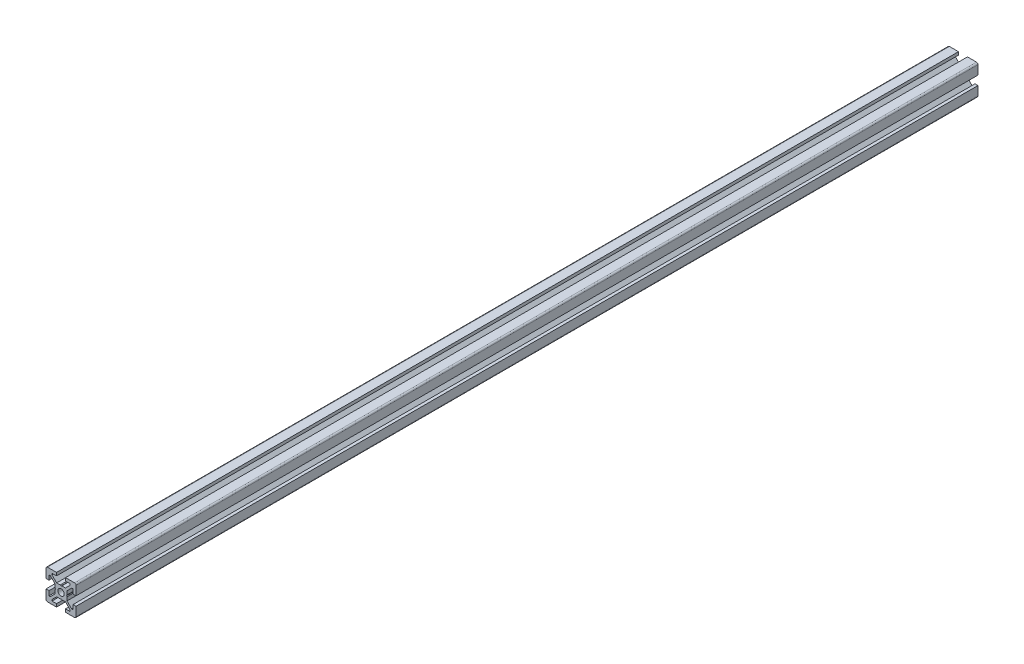
from build123d import *

# Parameters (mm, degrees)
SKETCH1_R           = 2.1
BOSS_EXTRUDE1_DEPTH = 600


with BuildPart() as part:
    # Sketch1 → Boss-Extrude1 (new body)
    with BuildSketch(Plane(origin=(0, 0, -500), x_dir=(-1, 0, 0), z_dir=(0, 0, -1))):
        with BuildLine():
            Line((9, 10), (3, 10))
            Line((3, 10), (3, 8))
            Line((3, 8), (6, 8))
            Line((6, 8), (6, 7.060660172))
            Line((6, 7.060660172), (2.939339828, 4))
            Line((2.939339828, 4), (0.519615242, 4))
            Line((0.519615242, 4), (0, 3.7))
            Line((0, 3.7), (-0.519615242, 4))
            Line((-0.519615242, 4), (-2.939339828, 4))
            Line((-2.939339828, 4), (-6, 7.060660172))
            Line((-6, 7.060660172), (-6, 8))
            Line((-6, 8), (-3, 8))
            Line((-3, 8), (-3, 10))
            Line((-3, 10), (-9, 10))
            ThreePointArc((-9, 10), (-9.707106781, 9.707106781), (-10, 9))
            Line((-10, 9), (-10, 3))
            Line((-10, 3), (-8, 3))
            Line((-8, 3), (-8, 6))
            Line((-8, 6), (-7.060660172, 6))
            Line((-7.060660172, 6), (-4, 2.939339828))
            Line((-4, 2.939339828), (-4, 0.519615242))
            Line((-4, 0.519615242), (-3.7, 0))
            Line((-3.7, 0), (-4, -0.519615242))
            Line((-4, -0.519615242), (-4, -2.939339828))
            Line((-4, -2.939339828), (-7.060660172, -6))
            Line((-7.060660172, -6), (-8, -6))
            Line((-8, -6), (-8, -3))
            Line((-8, -3), (-10, -3))
            Line((-10, -3), (-10, -9))
            ThreePointArc((-10, -9), (-9.707106781, -9.707106781), (-9, -10))
            Line((-9, -10), (-3, -10))
            Line((-3, -10), (-3, -8))
            Line((-3, -8), (-6, -8))
            Line((-6, -8), (-6, -7.060660172))
            Line((-6, -7.060660172), (-2.939339828, -4))
            Line((-2.939339828, -4), (-0.519615242, -4))
            Line((-0.519615242, -4), (0, -3.7))
            Line((0, -3.7), (0.519615242, -4))
            Line((0.519615242, -4), (2.939339828, -4))
            Line((2.939339828, -4), (6, -7.060660172))
            Line((6, -7.060660172), (6, -8))
            Line((6, -8), (3, -8))
            Line((3, -8), (3, -10))
            Line((3, -10), (9, -10))
            ThreePointArc((9, -10), (9.707106781, -9.707106781), (10, -9))
            Line((10, -9), (10, -3))
            Line((10, -3), (8, -3))
            Line((8, -3), (8, -6))
            Line((8, -6), (7.060660172, -6))
            Line((7.060660172, -6), (4, -2.939339828))
            Line((4, -2.939339828), (4, -0.519615242))
            Line((4, -0.519615242), (3.7, 0))
            Line((3.7, 0), (4, 0.519615242))
            Line((4, 0.519615242), (4, 2.939339828))
            Line((4, 2.939339828), (7.060660172, 6))
            Line((7.060660172, 6), (8, 6))
            Line((8, 6), (8, 3))
            Line((8, 3), (10, 3))
            Line((10, 3), (10, 9))
            ThreePointArc((10, 9), (9.707106781, 9.707106781), (9, 10))
        make_face()
        with Locations(Location((0, 0, 0), (0, 0, 180))):
            Circle(SKETCH1_R, mode=Mode.SUBTRACT)
    extrude(amount=-BOSS_EXTRUDE1_DEPTH)


solid = part.part
